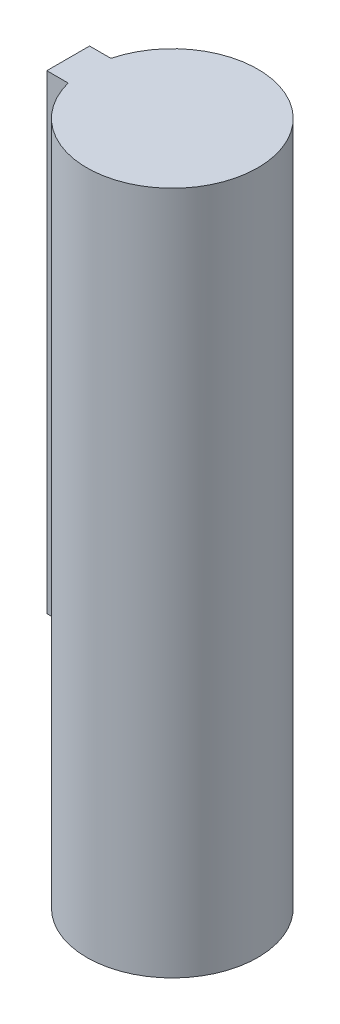
from build123d import *

# Parameters (mm, degrees)
SKETCH1_R           = 20
BOSS_EXTRUDE1_DEPTH = 80
BOSS_EXTRUDE2_DEPTH = 110


with BuildPart() as part:
    # Sketch1 → Boss-Extrude1 (new, symmetric)
    with BuildSketch(Plane(origin=(0, 0, 0), x_dir=(1, 0, 0), z_dir=(0, 1, 0))):
        with Locations(Location((0, 0, 0), (0, 0, 270))):
            Circle(SKETCH1_R)
    extrude(amount=BOSS_EXTRUDE1_DEPTH, both=True)

    # Sketch2 → Boss-Extrude2 (add)
    with BuildSketch(Plane(origin=(0, 80, 0), x_dir=(1, 0, 0), z_dir=(0, 1, 0))):
        with BuildLine():
            ThreePointArc((-19.364916731, -5), (-20, 0), (-19.364916731, 5))
            Line((-19.364916731, 5), (-24.364916731, 5))
            Line((-24.364916731, 5), (-24.364916731, -5))
            Line((-24.364916731, -5), (-19.364916731, -5))
        make_face()
    extrude(amount=-BOSS_EXTRUDE2_DEPTH)


solid = part.part
